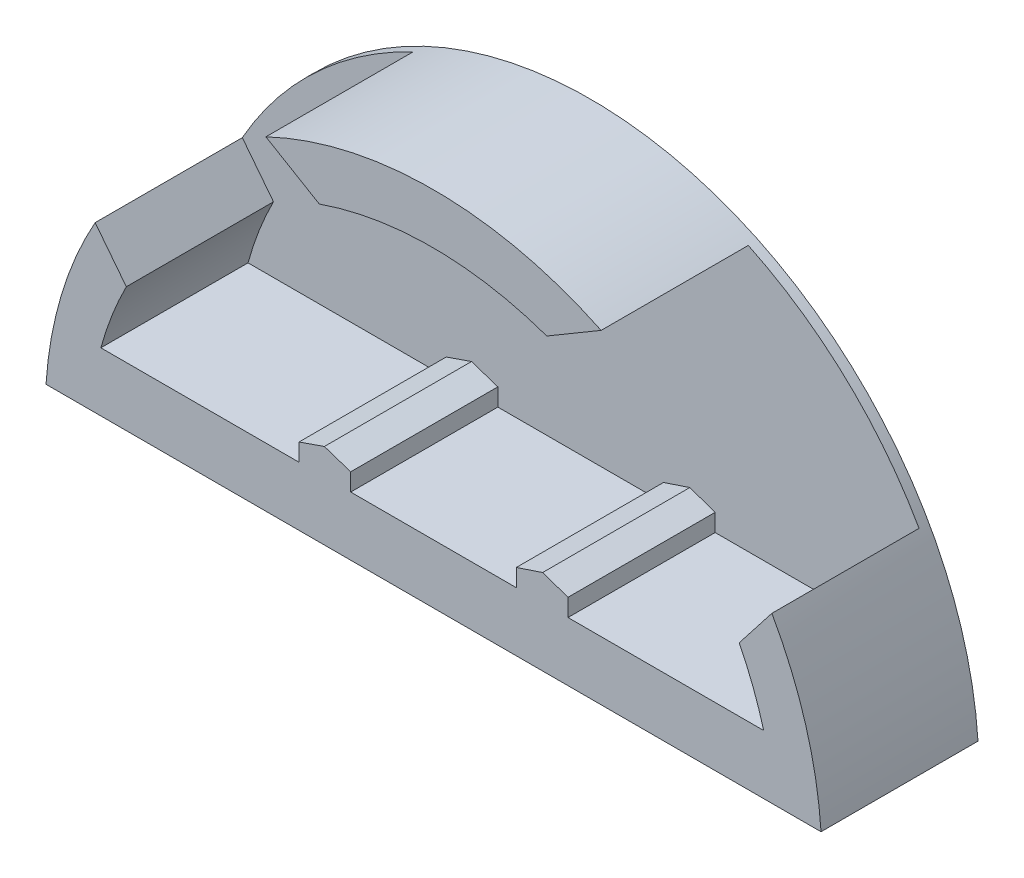
from build123d import *

# Parameters (mm, degrees)
BOSS_EXTRUDE1_DEPTH = 3.2
CUT_EXTRUDE1_DEPTH  = 3
CUT_EXTRUDE2_START  = -3
CUT_EXTRUDE2_DEPTH  = 3


with BuildPart() as part:
    # Sketch1 → Boss-Extrude1 (new body)
    with BuildSketch(Plane.XY):
        with BuildLine():
            Line((-8.349125364, 0), (7.450874636, 0))
            ThreePointArc((7.450874636, 0), (-0.449125364, 7.386183646), (-8.349125364, 0))
        make_face()
    extrude(amount=BOSS_EXTRUDE1_DEPTH)

    # Sketch3 → Cut-Extrude1 (cut)
    with BuildSketch(Plane.XY.offset(3.2)):
        with BuildLine():
            Line((-3.19080338, 1.203425656), (-3.19080338, 1.560959579))
            Line((-3.19080338, 1.560959579), (-2.674178491, 1.739791271))
            Line((-2.674178491, 1.739791271), (-2.137683415, 1.560959579))
            Line((-2.137683415, 1.560959579), (-2.137683415, 1.203425656))
            Line((-2.137683415, 1.203425656), (1.239432686, 1.203425656))
            Line((1.239432686, 1.203425656), (1.239432686, 1.560959579))
            Line((1.239432686, 1.560959579), (1.775927763, 1.739791271))
            Line((1.775927763, 1.739791271), (2.292552651, 1.560959579))
            Line((2.292552651, 1.560959579), (2.292552651, 1.203425656))
            Line((2.292552651, 1.203425656), (6.281891371, 1.203425656))
            ThreePointArc((6.281891371, 1.203425656), (-0.47432937, 6.35784653), (-7.230550111, 1.203425656))
            Line((-7.230550111, 1.203425656), (-3.19080338, 1.203425656))
        make_face()
    extrude(amount=-CUT_EXTRUDE1_DEPTH, mode=Mode.SUBTRACT)

    # Sketch6 → Cut-Extrude2 (cut)
    with BuildSketch(Plane.XY.offset(3.2).offset(CUT_EXTRUDE2_START)):
        with BuildLine():
            Line((-3.866358844, 6.61080504), (-2.777388902, 5.968436276))
            ThreePointArc((-2.777388902, 5.968436276), (-5.071279367, 4.630051211), (-6.711633725, 2.54140437))
            Line((-6.711633725, 2.54140437), (-7.346913092, 3.355884027))
            ThreePointArc((-7.346913092, 3.355884027), (-5.857317606, 5.251403586), (-3.866358844, 6.61080504))
        make_face()
        with BuildLine():
            Line((5.778219706, 2.496322182), (6.448662363, 3.355884027))
            ThreePointArc((6.448662363, 3.355884027), (4.959066878, 5.251403586), (2.968108115, 6.61080504))
            Line((2.968108115, 6.61080504), (1.854961189, 5.954174597))
            ThreePointArc((1.854961189, 5.954174597), (4.155461155, 4.609729053), (5.778219706, 2.496322182))
        make_face()
    extrude(amount=CUT_EXTRUDE2_DEPTH, mode=Mode.SUBTRACT)


solid = part.part
